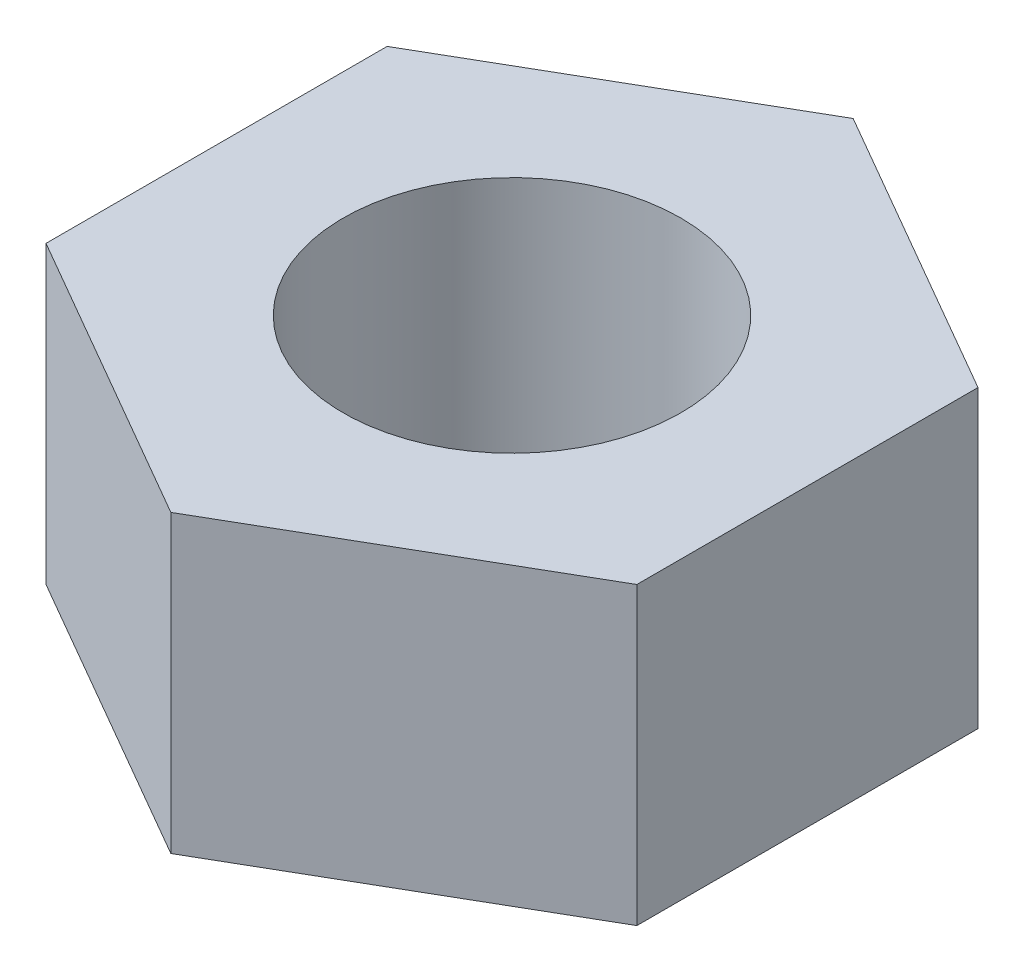
from build123d import *

# Parameters (mm, degrees)
BOSS_EXTRUDE1_DEPTH      = 2.778125
BOSS_EXTRUDE1_DEPTH_BACK = 2.778125
SKETCH11_R               = 3.175


with BuildPart() as part:
    # Sketch11 → Boss-Extrude1 (new, two sides: drawn at the far end of the back side and taken through both)
    with BuildSketch(Plane(origin=(0, 0, 0), x_dir=(1, 0, 0), z_dir=(0, 1, 0)).offset(-BOSS_EXTRUDE1_DEPTH_BACK)):
        Polygon((0, 6.415804866), (-5.55625, 3.207902433), (-5.55625, -3.207902433), (0, -6.415804866), (5.55625, -3.207902433), (5.55625, 3.207902433), align=None)
        with Locations(Location((0, 0, 0), (0, 0, 90))):
            Circle(SKETCH11_R, mode=Mode.SUBTRACT)
    extrude(amount=BOSS_EXTRUDE1_DEPTH + BOSS_EXTRUDE1_DEPTH_BACK)


solid = part.part
